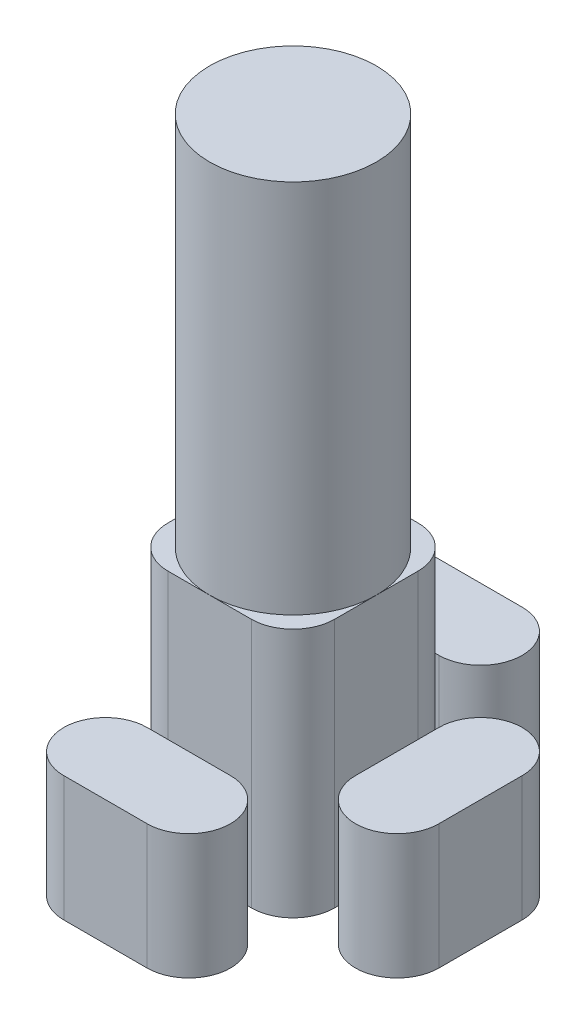
from build123d import *

# Parameters (mm, degrees)
BOSS_EXTRUDE1_DEPTH   = 0.6
BOSS_EXTRUDE1_2_DEPTH = 0.6
BOSS_EXTRUDE1_3_DEPTH = 0.6
BOSS_EXTRUDE1_4_DEPTH = 0.6
CUT_EXTRUDE1_DEPTH    = 0.3
SKETCH3_R             = 0.2
BOSS_EXTRUDE2_DEPTH   = 0.9


with BuildPart() as part:
    # Sketch1 → Boss-Extrude1 (new body)
    with BuildSketch(Plane(origin=(0, 0, 0), x_dir=(1, 0, 0), z_dir=(0, 1, 0))):
        with BuildLine():
            Line((-0.1, -0.2), (0.1, -0.2))
            ThreePointArc((0.1, -0.2), (0.170710678, -0.170710678), (0.2, -0.1))
            Line((0.2, -0.1), (0.2, 0.1))
            ThreePointArc((0.2, 0.1), (0.170710678, 0.170710678), (0.1, 0.2))
            Line((0.1, 0.2), (-0.1, 0.2))
            ThreePointArc((-0.1, 0.2), (-0.170710678, 0.170710678), (-0.2, 0.1))
            Line((-0.2, 0.1), (-0.2, -0.1))
            ThreePointArc((-0.2, -0.1), (-0.170710678, -0.170710678), (-0.1, -0.2))
        make_face()
    extrude(amount=BOSS_EXTRUDE1_DEPTH)

    # Sketch3 → Boss-Extrude2 (add)
    with BuildSketch(Plane(origin=(0, 0.6, 0), x_dir=(1, 0, 0), z_dir=(0, 1, 0))):
        with Locations(Location((0, 0, 0), (0, 0, 270))):
            Circle(SKETCH3_R)
    extrude(amount=BOSS_EXTRUDE2_DEPTH)


with BuildPart() as body_2:
    # Sketch1 → Boss-Extrude1 2 (new body)
    with BuildSketch(Plane(origin=(0, 0, 0), x_dir=(1, 0, 0), z_dir=(0, 1, 0))):
        with BuildLine():
            Line((0.45, -0.1), (0.45, 0.1))
            ThreePointArc((0.45, 0.1), (0.420710678, 0.170710678), (0.35, 0.2))
            ThreePointArc((0.35, 0.2), (0.279289322, 0.170710678), (0.25, 0.1))
            Line((0.25, 0.1), (0.25, -0.1))
            ThreePointArc((0.25, -0.1), (0.279289322, -0.170710678), (0.35, -0.2))
            ThreePointArc((0.35, -0.2), (0.420710678, -0.170710678), (0.45, -0.1))
        make_face()
    extrude(amount=BOSS_EXTRUDE1_2_DEPTH)


with BuildPart() as body_3:
    # Sketch1 → Boss-Extrude1 3 (new body)
    with BuildSketch(Plane(origin=(0, 0, 0), x_dir=(1, 0, 0), z_dir=(0, 1, 0))):
        with BuildLine():
            Line((0.1, 0.25), (-0.1, 0.25))
            ThreePointArc((-0.1, 0.25), (-0.170710678, 0.279289322), (-0.2, 0.35))
            ThreePointArc((-0.2, 0.35), (-0.170710678, 0.420710678), (-0.1, 0.45))
            Line((-0.1, 0.45), (0.1, 0.45))
            ThreePointArc((0.1, 0.45), (0.170710678, 0.420710678), (0.2, 0.35))
            ThreePointArc((0.2, 0.35), (0.170710678, 0.279289322), (0.1, 0.25))
        make_face()
    extrude(amount=BOSS_EXTRUDE1_3_DEPTH)


with BuildPart() as body_4:
    # Sketch1 → Boss-Extrude1 4 (new body)
    with BuildSketch(Plane(origin=(0, 0, 0), x_dir=(1, 0, 0), z_dir=(0, 1, 0))):
        with BuildLine():
            Line((0.1, -0.45), (-0.1, -0.45))
            ThreePointArc((-0.1, -0.45), (-0.170710678, -0.420710678), (-0.2, -0.35))
            ThreePointArc((-0.2, -0.35), (-0.170710678, -0.279289322), (-0.1, -0.25))
            Line((-0.1, -0.25), (0.1, -0.25))
            ThreePointArc((0.1, -0.25), (0.170710678, -0.279289322), (0.2, -0.35))
            ThreePointArc((0.2, -0.35), (0.170710678, -0.420710678), (0.1, -0.45))
        make_face()
    extrude(amount=BOSS_EXTRUDE1_4_DEPTH)


with BuildPart() as cut_extrude1_tool:
    # Sketch2 → Cut-Extrude1 (new body)
    with BuildSketch(Plane(origin=(0, 0.6, 0), x_dir=(1, 0, 0), z_dir=(0, 1, 0))):
        with BuildLine():
            Line((-0.1, -0.45), (0.1, -0.45))
            ThreePointArc((0.1, -0.45), (0.2, -0.35), (0.1, -0.25))
            Line((0.1, -0.25), (-0.1, -0.25))
            ThreePointArc((-0.1, -0.25), (-0.2, -0.35), (-0.1, -0.45))
        make_face()
        with BuildLine():
            Line((0.25, 0.1), (0.25, -0.1))
            ThreePointArc((0.25, -0.1), (0.35, -0.2), (0.45, -0.1))
            Line((0.45, -0.1), (0.45, 0.1))
            ThreePointArc((0.45, 0.1), (0.35, 0.2), (0.25, 0.1))
        make_face()
        with BuildLine():
            Line((-0.1, 0.25), (0.1, 0.25))
            ThreePointArc((0.1, 0.25), (0.2, 0.35), (0.1, 0.45))
            Line((0.1, 0.45), (-0.1, 0.45))
            ThreePointArc((-0.1, 0.45), (-0.2, 0.35), (-0.1, 0.25))
        make_face()
    extrude(amount=-CUT_EXTRUDE1_DEPTH)


with BuildPart() as body_2_1:
    add(body_2.part)

    # Cut-Extrude1: cut by cut_extrude1_tool
    add(cut_extrude1_tool.part, mode=Mode.SUBTRACT)


with BuildPart() as body_3_1:
    add(body_3.part)

    # Cut-Extrude1: cut by cut_extrude1_tool
    add(cut_extrude1_tool.part, mode=Mode.SUBTRACT)


with BuildPart() as body_4_1:
    add(body_4.part)

    # Cut-Extrude1: cut by cut_extrude1_tool
    add(cut_extrude1_tool.part, mode=Mode.SUBTRACT)


solid = Compound([part.part, body_2_1.part, body_3_1.part, body_4_1.part])
